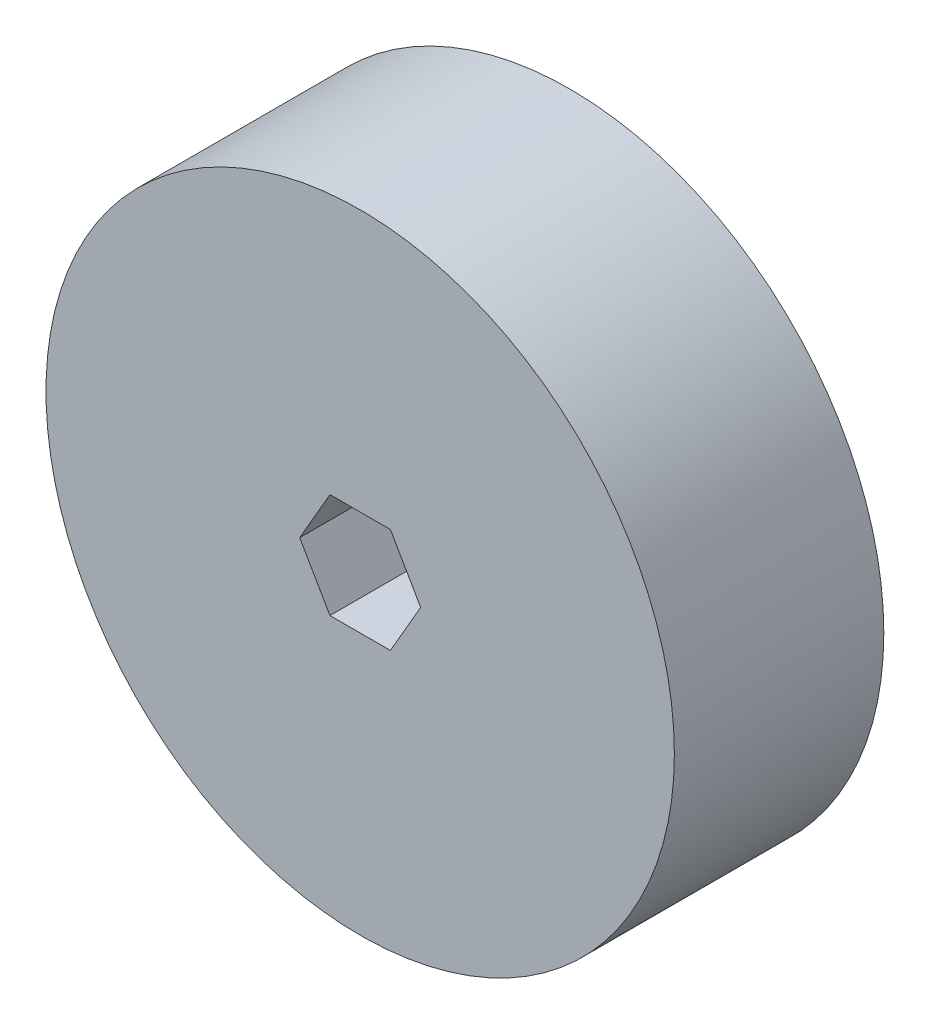
from build123d import *

# Parameters (mm, degrees)
SKETCH1_R           = 38.1
BOSS_EXTRUDE1_DEPTH = 25.4


with BuildPart() as part:
    # Sketch1 → Boss-Extrude1 (new body)
    with BuildSketch(Plane.XY):
        Circle(SKETCH1_R)
        Polygon((-3.666174209, 6.35), (-7.332348419, 0), (-3.666174209, -6.35), (3.666174209, -6.35), (7.332348419, 0), (3.666174209, 6.35), align=None, mode=Mode.SUBTRACT)
    extrude(amount=BOSS_EXTRUDE1_DEPTH)


solid = part.part
